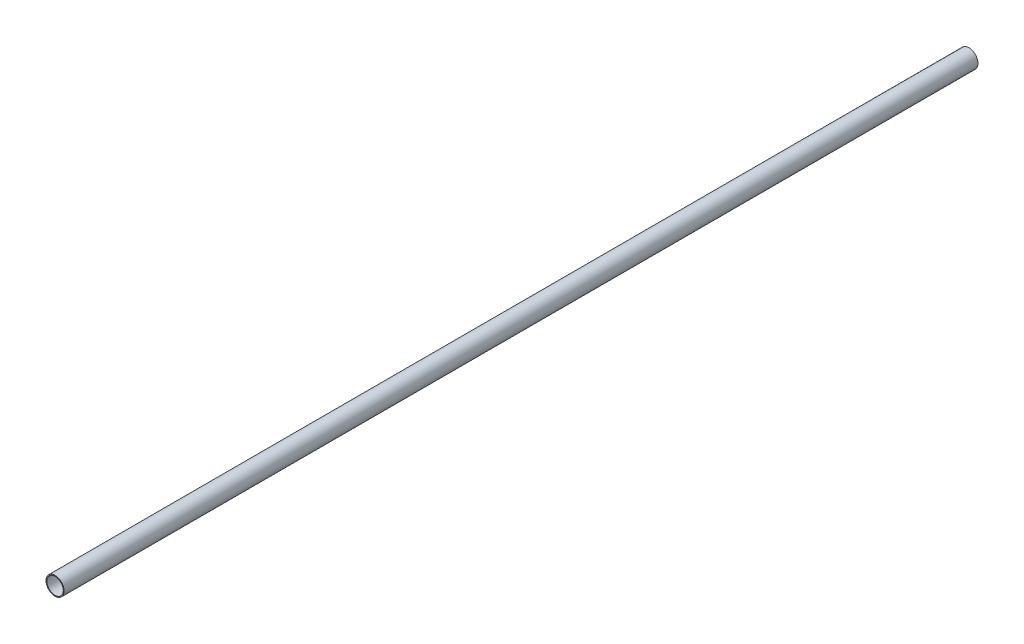
from build123d import *

# Parameters (mm, degrees)
SKETCH1_R           = 1.984375
SKETCH1_R_2         = 1.8
BOSS_EXTRUDE1_DEPTH = 200


with BuildPart() as part:
    # Sketch1 → Boss-Extrude1 (new body)
    with BuildSketch(Plane.XY):
        Circle(SKETCH1_R)
        Circle(SKETCH1_R_2, mode=Mode.SUBTRACT)
    extrude(amount=BOSS_EXTRUDE1_DEPTH)


solid = part.part
